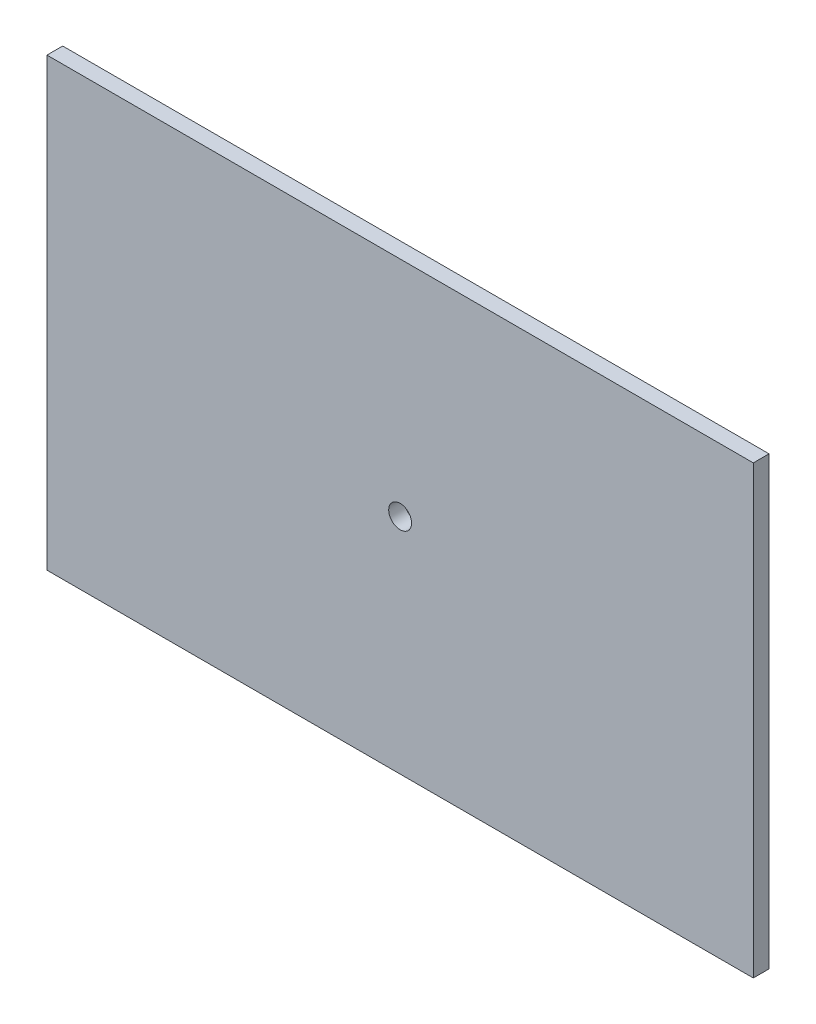
from build123d import *

# Parameters (mm, degrees)
SKETCH1_W           = 784.225
SKETCH1_H           = 495.3
BOSS_EXTRUDE1_DEPTH = 17.4625
SKETCH2_R           = 12.7
CUT_EXTRUDE1_DEPTH  = 17.4625


with BuildPart() as part:
    # Sketch1 → Boss-Extrude1 (new body)
    with BuildSketch(Plane.XY):
        with Locations((392.1125, 247.65)):
            Rectangle(SKETCH1_W, SKETCH1_H)
    extrude(amount=BOSS_EXTRUDE1_DEPTH)

    # Sketch2 → Cut-Extrude1 (cut)
    with BuildSketch(Plane.XY.offset(17.4625)):
        with Locations((392.1125, 247.65)):
            Circle(SKETCH2_R)
    extrude(amount=-CUT_EXTRUDE1_DEPTH, mode=Mode.SUBTRACT)


solid = part.part
